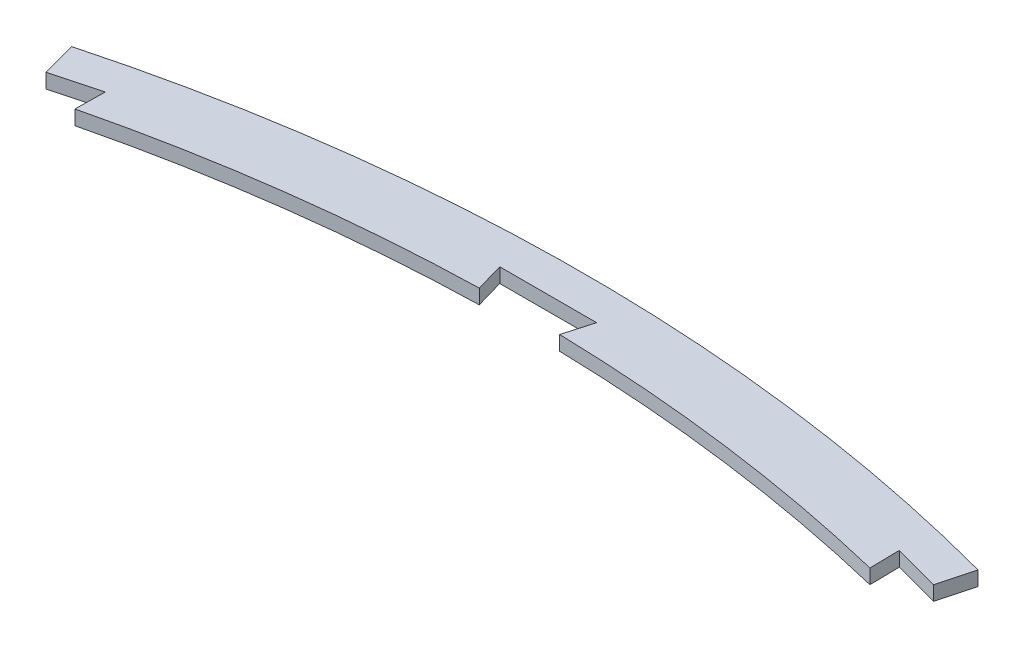
from build123d import *

# Parameters (mm, degrees)
BOSS_EXTRUDE1_DEPTH = 9


with BuildPart() as part:
    # Sketch1 → Boss-Extrude1 (new body)
    with BuildSketch(Plane(origin=(0, 0, 0), x_dir=(1, 0, 0), z_dir=(0, 1, 0))):
        with BuildLine():
            Line((-280.818663936, 1048.029521524), (-274.995235421, 1026.296190432))
            Line((-274.995235421, 1026.296190432), (-246.017460633, 1034.060761785))
            Line((-246.017460633, 1034.060761785), (-246.317756475, 1015.8629646))
            Line((-246.317756475, 1015.8629646), (-246.322853924, 1015.554061404))
            ThreePointArc((-246.322853924, 1015.554061404), (-136.39987087, 1036.059880136), (-24.915126212, 1044.702941743))
            Line((-24.915126212, 1044.702941743), (-25, 1045))
            Line((-25, 1045), (-30, 1062.5))
            Line((-30, 1062.5), (30, 1062.5))
            Line((30, 1062.5), (25, 1045))
            Line((25, 1045), (24.915126212, 1044.702941743))
            ThreePointArc((24.915126212, 1044.702941743), (136.39987087, 1036.059880136), (246.322853924, 1015.554061404))
            Line((246.322853924, 1015.554061404), (246.317756475, 1015.8629646))
            Line((246.317756475, 1015.8629646), (246.017460633, 1034.060761785))
            Line((246.017460633, 1034.060761785), (274.995235421, 1026.296190432))
            Line((274.995235421, 1026.296190432), (280.818663936, 1048.029521524))
            ThreePointArc((280.818663936, 1048.029521524), (0, 1085), (-280.818663936, 1048.029521524))
        make_face()
    extrude(amount=BOSS_EXTRUDE1_DEPTH)


solid = part.part
